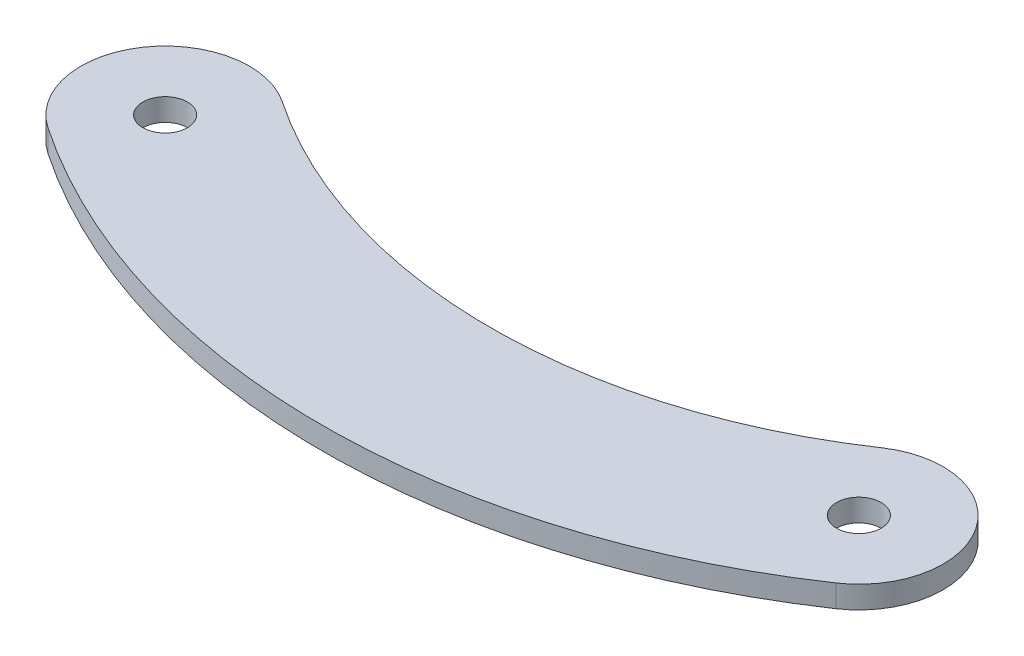
from build123d import *

# Parameters (mm, degrees)
SKETCH1_R           = 1.5875
BOSS_EXTRUDE1_DEPTH = 0.79375


with BuildPart() as part:
    # Sketch1 → Boss-Extrude1 (new, symmetric)
    with BuildSketch(Plane(origin=(0, 0, 0), x_dir=(1, 0, 0), z_dir=(0, 1, 0))):
        with BuildLine():
            ThreePointArc((-21.319139699, 4.975774091), (0, -1.536759472), (21.319139699, 4.975774091))
            ThreePointArc((21.319139699, 4.975774091), (29.647774091, 3.352860301), (28.024860301, -4.975774091))
            ThreePointArc((28.024860301, -4.975774091), (0, -13.536759472), (-28.024860301, -4.975774091))
            ThreePointArc((-28.024860301, -4.975774091), (-29.647774091, 3.352860301), (-21.319139699, 4.975774091))
        make_face()
        with Locations(Location((-24.672, 0, 0), (0, 0, 270))):
            Circle(SKETCH1_R, mode=Mode.SUBTRACT)
        with Locations(Location((24.672, 0, 0), (0, 0, 270))):
            Circle(SKETCH1_R, mode=Mode.SUBTRACT)
    extrude(amount=BOSS_EXTRUDE1_DEPTH, both=True)


solid = part.part
